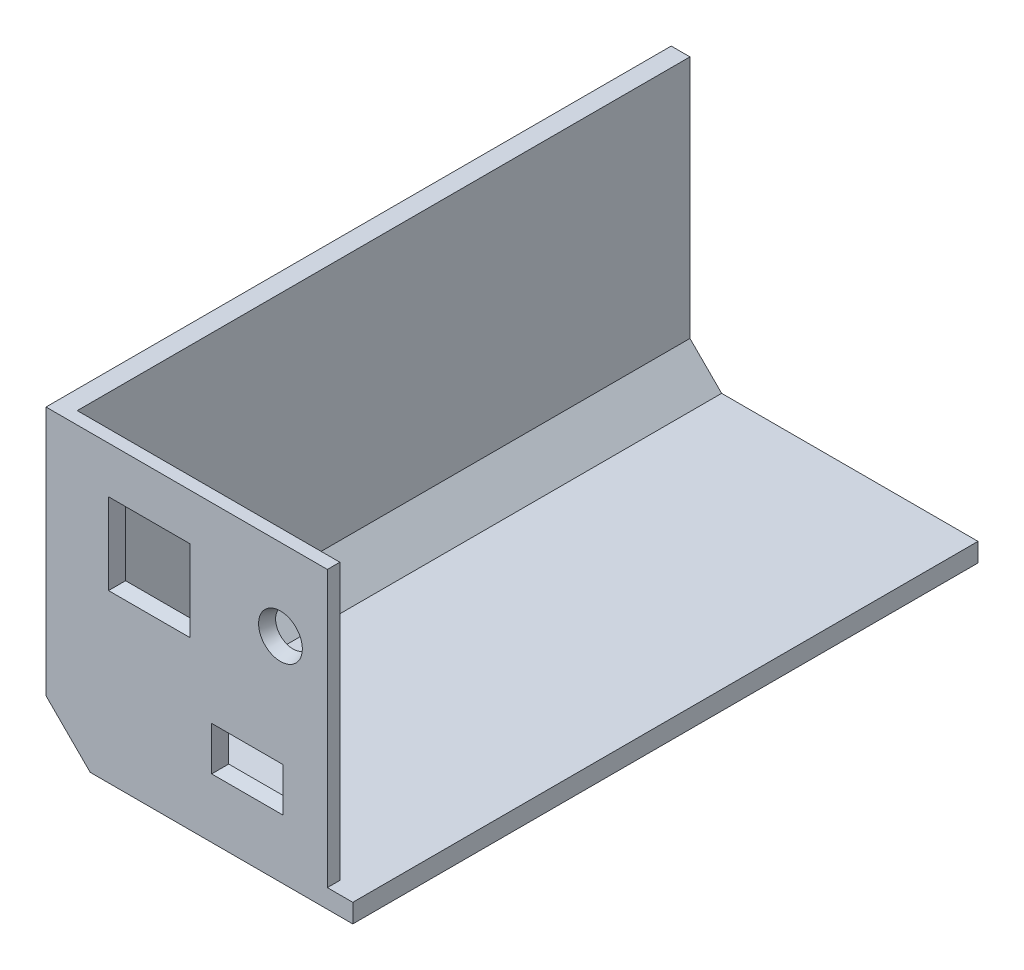
from build123d import *

# Parameters (mm, degrees)
BOSS_EXTRUDE1_DEPTH          = 100
BOSS_EXTRUDE2_DEPTH          = 2
CUT_EXTRUDE2_REACH           = 120.237
SKETCH4_R                    = 2.75
CUT_EXTRUDE3_REACH           = 120.237
SKETCH5_W                    = 9
SKETCH5_H                    = 4
CUT_EXTRUDE4_REACH           = 120.237
SKETCH6_W                    = 10
SKETCH6_H                    = 10
SKETCH7_R                    = 3.5
CUT_EXTRUDE6_DEPTH           = 2
CUT_EXTRUDE6_DRAFT           = -20
SKETCH7_W                    = 11.447026043
SKETCH7_H                    = 7
CUT_EXTRUDE6_PROFILE_2_DEPTH = 2
CUT_EXTRUDE6_PROFILE_2_DRAFT = -20
SKETCH7_W_2                  = 13
SKETCH7_H_2                  = 13
CUT_EXTRUDE6_PROFILE_3_DEPTH = 2
CUT_EXTRUDE6_PROFILE_3_DRAFT = -20


with BuildPart() as part:
    # Sketch2 → Boss-Extrude1 (new body)
    with BuildSketch(Plane.XY):
        Polygon((-7.071067812, 47.073759399), (-4.071067812, 47.073759399), (-4.071067812, 8.071067812), (1, 3), (42, 3), (42, 0), (0, 0), (-7.071067812, 7.071067812), align=None)
    extrude(amount=BOSS_EXTRUDE1_DEPTH)

    # Sketch3 → Boss-Extrude2 (add)
    with BuildSketch(Plane.XY.offset(100)):
        Polygon((-4.071067812, 47.073759399), (37.928932188, 47.073759399), (37.928932188, 3), (1, 3), (-4.071067812, 8.071067812), align=None)
    extrude(amount=-BOSS_EXTRUDE2_DEPTH)

    # Sketch4 → Cut-Extrude2 (cut, up to next)
    with BuildSketch(Plane.XY.offset(100), mode=Mode.PRIVATE) as cut_extrude2_sk1:
        with Locations((30.428932188, 34.073759399)):
            Circle(SKETCH4_R)
    cut_extrude2_tool1 = extrude(cut_extrude2_sk1.sketch, amount=-CUT_EXTRUDE2_REACH, mode=Mode.PRIVATE) & part.part
    add(cut_extrude2_tool1.solids().sort_by_distance((30.428932, 34.073759, 100))[0], mode=Mode.SUBTRACT)

    # Sketch5 → Cut-Extrude3 (cut, up to next)
    with BuildSketch(Plane.XY.offset(100), mode=Mode.PRIVATE) as cut_extrude3_sk1:
        with Locations((25.428932188, 13)):
            Rectangle(SKETCH5_W, SKETCH5_H)
    cut_extrude3_tool1 = extrude(cut_extrude3_sk1.sketch, amount=-CUT_EXTRUDE3_REACH, mode=Mode.PRIVATE) & part.part
    add(cut_extrude3_tool1.solids().sort_by_distance((25.428932, 13, 100))[0], mode=Mode.SUBTRACT)

    # Sketch6 → Cut-Extrude4 (cut, up to next)
    with BuildSketch(Plane.XY.offset(100), mode=Mode.PRIVATE) as cut_extrude4_sk1:
        with Locations((9.428932188, 33.144002223)):
            Rectangle(SKETCH6_W, SKETCH6_H)
    cut_extrude4_tool1 = extrude(cut_extrude4_sk1.sketch, amount=-CUT_EXTRUDE4_REACH, mode=Mode.PRIVATE) & part.part
    add(cut_extrude4_tool1.solids().sort_by_distance((9.428932, 33.144002, 100))[0], mode=Mode.SUBTRACT)


with BuildPart() as cut_extrude6_tool:
    # Sketch7 → Cut-Extrude6 (with draft: the straight prism first)
    with BuildSketch(Plane.XY.offset(100)):
        with Locations((30.428932188, 34.073759399)):
            Circle(SKETCH7_R)
    extrude(amount=-CUT_EXTRUDE6_DEPTH)
    # Cut-Extrude6: the draft: its side faces are tilted about the plane it starts from
    cut_extrude6_sides = [cut_extrude6_tool.faces().sort_by_distance(p)[0] for p in [
        (26.928932188, 34.073759399, 99),
    ]]
    draft(cut_extrude6_sides, Plane.XY.offset(100), CUT_EXTRUDE6_DRAFT)


with BuildPart() as part_1:
    add(part.part)

    # Cut-Extrude6: cut by cut_extrude6_tool
    add(cut_extrude6_tool.part, mode=Mode.SUBTRACT)


with BuildPart() as cut_extrude6_profile_2_tool:
    # Sketch7 → Cut-Extrude6 profile 2 (with draft: the straight prism first)
    with BuildSketch(Plane.XY.offset(100)):
        with Locations((25.15244521, 13)):
            Rectangle(SKETCH7_W, SKETCH7_H)
    extrude(amount=-CUT_EXTRUDE6_PROFILE_2_DEPTH)
    # Cut-Extrude6 profile 2: the draft: its side faces are tilted about the plane it starts from
    cut_extrude6_profile_2_sides = [cut_extrude6_profile_2_tool.faces().sort_by_distance(p)[0] for p in [
        (19.428932188, 13, 99),
        (25.15244521, 9.5, 99),
        (30.875958231, 13, 99),
        (25.15244521, 16.5, 99),
    ]]
    draft(cut_extrude6_profile_2_sides, Plane.XY.offset(100), CUT_EXTRUDE6_PROFILE_2_DRAFT)


with BuildPart() as part_2:
    add(part_1.part)

    # Cut-Extrude6 profile 2: cut by cut_extrude6_profile_2_tool
    add(cut_extrude6_profile_2_tool.part, mode=Mode.SUBTRACT)


with BuildPart() as cut_extrude6_profile_3_tool:
    # Sketch7 → Cut-Extrude6 profile 3 (with draft: the straight prism first)
    with BuildSketch(Plane.XY.offset(100)):
        with Locations((9.428932188, 33.144002223)):
            Rectangle(SKETCH7_W_2, SKETCH7_H_2)
    extrude(amount=-CUT_EXTRUDE6_PROFILE_3_DEPTH)
    # Cut-Extrude6 profile 3: the draft: its side faces are tilted about the plane it starts from
    cut_extrude6_profile_3_sides = [cut_extrude6_profile_3_tool.faces().sort_by_distance(p)[0] for p in [
        (2.928932188, 33.144002223, 99),
        (9.428932188, 26.644002223, 99),
        (15.928932188, 33.144002223, 99),
        (9.428932188, 39.644002223, 99),
    ]]
    draft(cut_extrude6_profile_3_sides, Plane.XY.offset(100), CUT_EXTRUDE6_PROFILE_3_DRAFT)


with BuildPart() as part_3:
    add(part_2.part)

    # Cut-Extrude6 profile 3: cut by cut_extrude6_profile_3_tool
    add(cut_extrude6_profile_3_tool.part, mode=Mode.SUBTRACT)


solid = part_3.part
